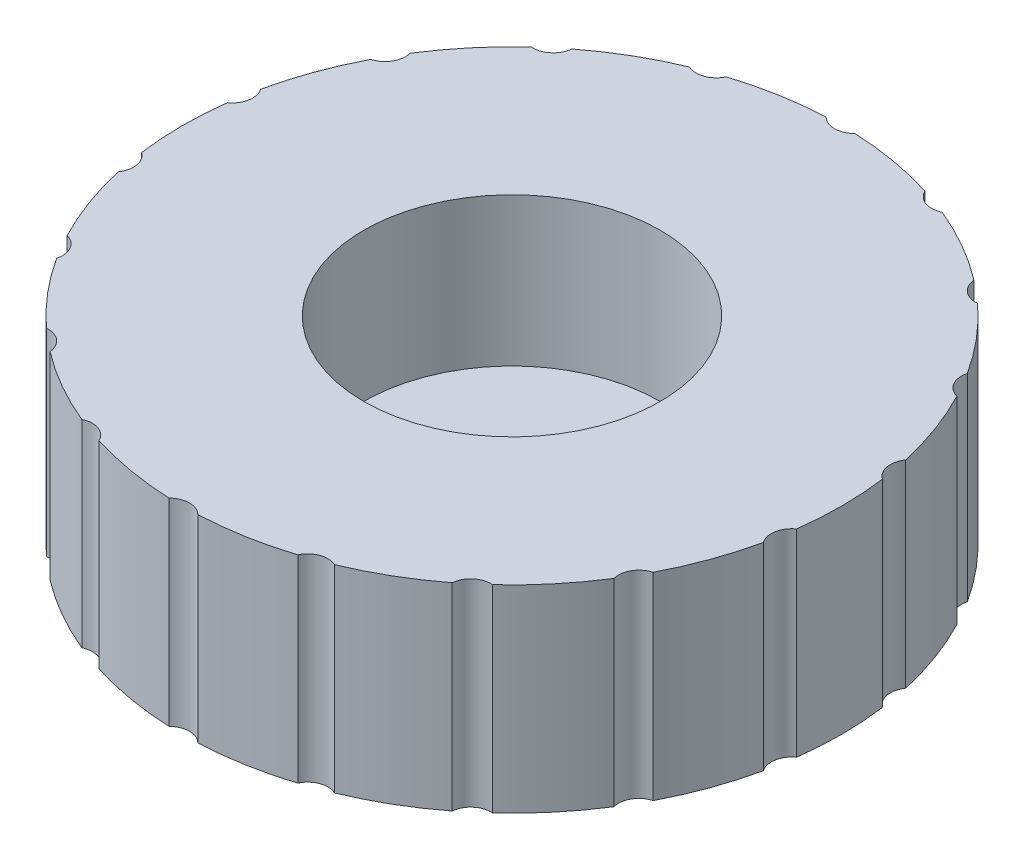
from build123d import *

# Parameters (mm, degrees)
SKETCH1_R           = 100
SKETCH1_R_2         = 45
BOSS_EXTRUDE1_DEPTH = 60
SKETCH2_R           = 45
BOSS_EXTRUDE2_DEPTH = 15
CUT_EXTRUDE2_DEPTH  = 85
SKETCH5_R           = 70
CUT_EXTRUDE3_DEPTH  = 5
CUT_EXTRUDE4_DEPTH  = 50


with BuildPart() as part:
    # Sketch1 → Boss-Extrude1 (new body)
    with BuildSketch(Plane(origin=(0, 0, 0), x_dir=(1, 0, 0), z_dir=(0, 1, 0))):
        with Locations(Location((0, 0, 0), (0, 0, 270))):
            Circle(SKETCH1_R)
        with Locations(Location((0, 0, 0), (0, 0, 270))):
            Circle(SKETCH1_R_2, mode=Mode.SUBTRACT)
    extrude(amount=BOSS_EXTRUDE1_DEPTH)

    # Sketch2 → Boss-Extrude2 (add)
    with BuildSketch(Plane.XZ):
        with Locations(Location((0, 0, 0), (0, 0, 270))):
            Circle(SKETCH2_R)
    extrude(amount=-BOSS_EXTRUDE2_DEPTH)

    # Sketch4 → Cut-Extrude2 (cut)
    with BuildSketch(Plane(origin=(0, 60, 0), x_dir=(1, 0, 0), z_dir=(0, 1, 0))):
        with BuildLine():
            ThreePointArc((-4.583072667, 99.894922018), (-0.223462851, 98.100736099), (4.127927842, 99.914764733))
            ThreePointArc((4.127927842, 99.914764733), (-0.236423106, 103.790319504), (-4.583072667, 99.894922018))
        make_face()
        with BuildLine():
            ThreePointArc((29.85939598, 95.438024244), (33.342441429, 92.260966602), (38.051845487, 92.477332655))
            ThreePointArc((38.051845487, 92.477332655), (35.276214905, 97.611858812), (29.85939598, 95.438024244))
        make_face()
        with BuildLine():
            ThreePointArc((60.700380795, 79.469892232), (62.88675519, 75.293162907), (67.386148981, 73.885769439))
            ThreePointArc((67.386148981, 73.885769439), (66.534020776, 79.659967349), (60.700380795, 79.469892232))
        make_face()
        with BuildLine():
            ThreePointArc((84.220003843, 53.916518366), (84.845998166, 49.243892556), (88.592688393, 46.38249199))
            ThreePointArc((88.592688393, 46.38249199), (89.766841805, 52.099908168), (84.220003843, 53.916518366))
        make_face()
        with BuildLine():
            ThreePointArc((97.581451473, 21.860016662), (96.57156157, 17.255082), (99.113642097, 13.284801475))
            ThreePointArc((99.113642097, 13.284801475), (102.172456894, 18.255831149), (97.581451473, 21.860016662))
        make_face()
        with BuildLine():
            ThreePointArc((99.173135906, -12.833125672), (96.649169404, -16.814946103), (97.680027802, -21.415232161))
            ThreePointArc((97.680027802, -21.415232161), (102.254565777, -17.790168534), (99.173135906, -12.833125672))
        make_face()
        with BuildLine():
            ThreePointArc((88.80307651, -45.978403652), (85.069461017, -48.856843544), (84.464760551, -53.532272743))
            ThreePointArc((84.464760551, -53.532272743), (90.003264911, -51.690411336), (88.80307651, -45.978403652))
        make_face()
        with BuildLine():
            ThreePointArc((67.722055492, -73.578007583), (63.229120141, -75.005884603), (61.06179661, -79.19253118))
            ThreePointArc((61.06179661, -79.19253118), (66.896241989, -79.356027663), (67.722055492, -73.578007583))
        make_face()
        with BuildLine():
            ThreePointArc((38.472755112, -92.303017904), (33.762414213, -92.10810901), (30.293878822, -95.3010016))
            ThreePointArc((30.293878822, -95.3010016), (35.720545001, -97.450135883), (38.472755112, -92.303017904))
        make_face()
        with BuildLine():
            ThreePointArc((4.583072667, -99.894922018), (0.223462851, -98.100736099), (-4.127927842, -99.914764733))
            ThreePointArc((-4.127927842, -99.914764733), (0.236423106, -103.790319504), (4.583072667, -99.894922018))
        make_face()
        with BuildLine():
            ThreePointArc((-29.85939598, -95.438024244), (-33.342441429, -92.260966602), (-38.051845487, -92.477332655))
            ThreePointArc((-38.051845487, -92.477332655), (-35.276214905, -97.611858812), (-29.85939598, -95.438024244))
        make_face()
        with BuildLine():
            ThreePointArc((-60.700380795, -79.469892232), (-62.88675519, -75.293162907), (-67.386148981, -73.885769439))
            ThreePointArc((-67.386148981, -73.885769439), (-66.534020776, -79.659967349), (-60.700380795, -79.469892232))
        make_face()
        with BuildLine():
            ThreePointArc((-84.220003843, -53.916518366), (-84.845998166, -49.243892556), (-88.592688393, -46.38249199))
            ThreePointArc((-88.592688393, -46.38249199), (-89.766841805, -52.099908168), (-84.220003843, -53.916518366))
        make_face()
        with BuildLine():
            ThreePointArc((-97.581451473, -21.860016662), (-96.57156157, -17.255082), (-99.113642097, -13.284801475))
            ThreePointArc((-99.113642097, -13.284801475), (-102.172456894, -18.255831149), (-97.581451473, -21.860016662))
        make_face()
        with BuildLine():
            ThreePointArc((-99.173135906, 12.833125672), (-96.649169404, 16.814946103), (-97.680027802, 21.415232161))
            ThreePointArc((-97.680027802, 21.415232161), (-102.254565777, 17.790168534), (-99.173135906, 12.833125672))
        make_face()
        with BuildLine():
            ThreePointArc((-88.80307651, 45.978403652), (-85.069461017, 48.856843544), (-84.464760551, 53.532272743))
            ThreePointArc((-84.464760551, 53.532272743), (-90.003264911, 51.690411336), (-88.80307651, 45.978403652))
        make_face()
        with BuildLine():
            ThreePointArc((-67.722055492, 73.578007583), (-63.229120141, 75.005884603), (-61.06179661, 79.19253118))
            ThreePointArc((-61.06179661, 79.19253118), (-66.896241989, 79.356027663), (-67.722055492, 73.578007583))
        make_face()
        with BuildLine():
            ThreePointArc((-38.472755112, 92.303017904), (-33.762414213, 92.10810901), (-30.293878822, 95.3010016))
            ThreePointArc((-30.293878822, 95.3010016), (-35.720545001, 97.450135883), (-38.472755112, 92.303017904))
        make_face()
    extrude(amount=-CUT_EXTRUDE2_DEPTH, mode=Mode.SUBTRACT)

    # Sketch5 → Cut-Extrude3 (cut)
    with BuildSketch(Plane.XZ):
        with Locations(Location((0, 0, 0), (0, 0, 270))):
            Circle(SKETCH5_R)
    extrude(amount=-CUT_EXTRUDE3_DEPTH, mode=Mode.SUBTRACT)

    # Sketch3 → Cut-Extrude4 (cut)
    with BuildSketch(Plane(origin=(0, 15, 0), x_dir=(1, 0, 0), z_dir=(0, 1, 0))):
        with BuildLine():
            Line((-6.5, 1.5), (-5.291502622, 1.5))
            ThreePointArc((-5.291502622, 1.5), (5.5, 0), (-5.291502622, -1.5))
            Line((-5.291502622, -1.5), (-6.5, -1.5))
            Line((-6.5, -1.5), (-6.5, 1.5))
        make_face()
    extrude(amount=-CUT_EXTRUDE4_DEPTH, mode=Mode.SUBTRACT)


solid = part.part
